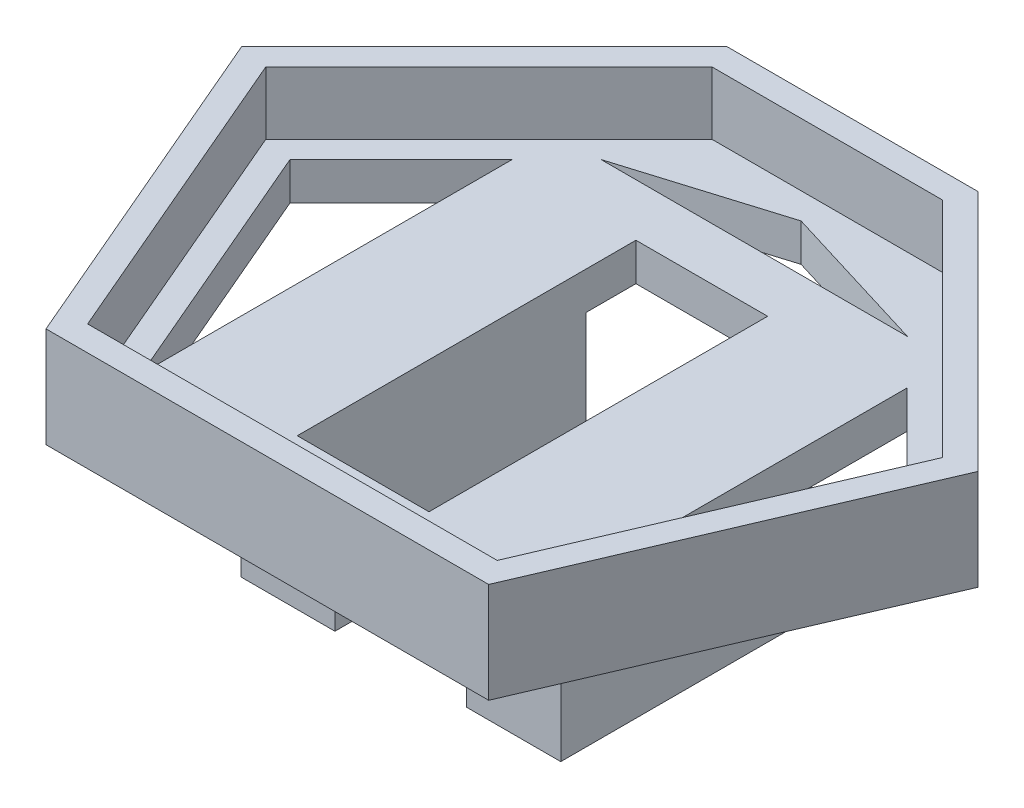
from build123d import *

# Parameters (mm, degrees)
BOSS_EXTRUDE1_DEPTH = 5
BOSS_EXTRUDE2_DEPTH = 3
SKETCH3_W           = 7.507408842
SKETCH3_H           = 20
BOSS_EXTRUDE3_DEPTH = 12
SKETCH5_W           = 19.5
SKETCH5_H           = 2.15
CUT_EXTRUDE2_DEPTH  = 18
CUT_EXTRUDE3_DEPTH  = 50.600358979


with BuildPart() as part:
    # Sketch1 → Boss-Extrude1 (new body)
    with BuildSketch(Plane(origin=(0, 0, 0), x_dir=(1, 0, 0), z_dir=(0, 1, 0))):
        Polygon((10.024698463, 8.496116817), (-10.024698463, 8.496116817), (-29.349158436, -10.828343156), (-17.64879837, -38.142135624), (17.64879837, -38.142135624), (29.349158436, -10.828343156), align=None)
        Polygon((9.196271338, 6.496116817), (-9.196271338, 6.496116817), (-26.977652736, -11.28526458), (-16.329759674, -36.142135624), (16.329759674, -36.142135624), (26.977652736, -11.28526458), align=None, mode=Mode.SUBTRACT)
    extrude(amount=BOSS_EXTRUDE1_DEPTH)

    # Sketch2 → Boss-Extrude2 (add)
    with BuildSketch(Plane(origin=(0, 0, 0), x_dir=(-1, 0, 0), z_dir=(0, -1, 0))):
        Polygon((17.64879837, -38.142135624), (-17.64879837, -38.142135624), (-29.349158436, -10.828343156), (-10.024698463, 8.496116817), (10.024698463, 8.496116817), (29.349158436, -10.828343156), align=None)
    extrude(amount=BOSS_EXTRUDE2_DEPTH)

    # Sketch3 → Boss-Extrude3 (add)
    with BuildSketch(Plane(origin=(0, -3, 0), x_dir=(-1, 0, 0), z_dir=(0, -1, 0))):
        with Locations((9.003704421, -17.503883183)):
            Rectangle(SKETCH3_W, SKETCH3_H)
        with Locations((-9.003704421, -17.503883183)):
            Rectangle(SKETCH3_W, SKETCH3_H)
    extrude(amount=BOSS_EXTRUDE3_DEPTH)

    # Sketch5 → Cut-Extrude2 (cut)
    with BuildSketch(Plane(origin=(0, 0, 7.503883183), x_dir=(-1, 0, 0), z_dir=(0, 0, -1))):
        with Locations((0, -11.925)):
            Rectangle(SKETCH5_W, SKETCH5_H)
    extrude(amount=-CUT_EXTRUDE2_DEPTH, mode=Mode.SUBTRACT)

    # Sketch6 → Cut-Extrude3 (cut, through all)
    with BuildSketch(Plane(origin=(0, -3, 0), x_dir=(-1, 0, 0), z_dir=(0, -1, 0))):
        Polygon((5.25, -7.503883183), (5.25, -30.503883183), (-5.25, -30.503883183), (-5.25, -5.503883183), (-5.25, -3.503883183), (5.25, -3.503883183), align=None)
        Polygon((-24.606147036, -11.742186005), (-15.757408842, -32.399037357), (-15.757408842, -2.893447811), align=None)
        Polygon((-12.219190477, 0.676990597), (12.219190477, 0.676990597), (0, 4.412772028), align=None)
        Polygon((15.757408842, -2.893447811), (24.606147036, -11.742186005), (15.757408842, -32.399037357), align=None)
    extrude(amount=-CUT_EXTRUDE3_DEPTH, mode=Mode.SUBTRACT)


solid = part.part
